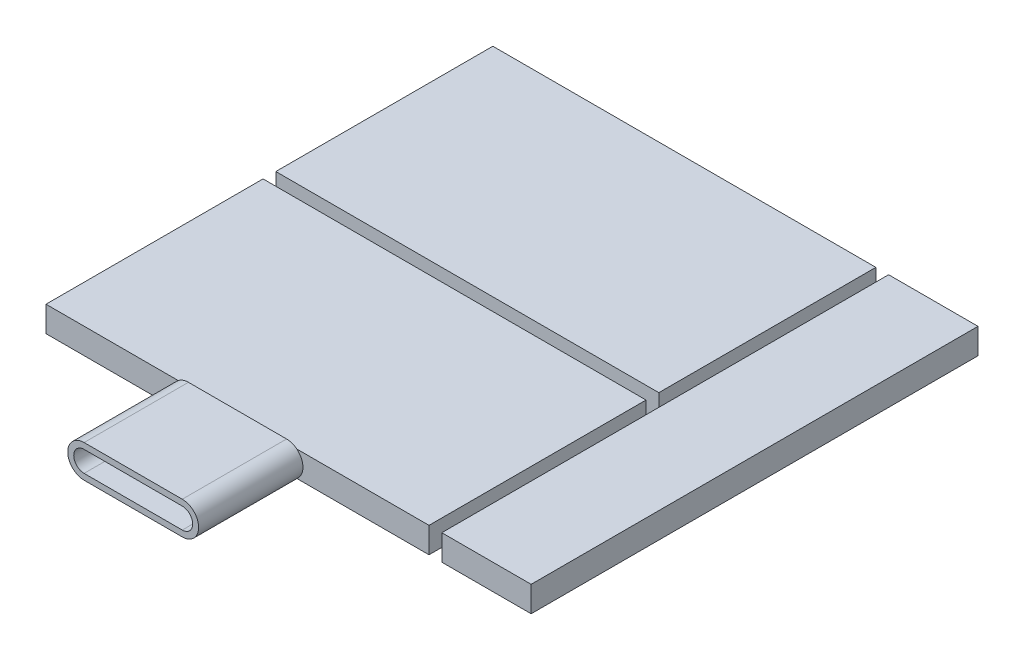
from build123d import *

# Parameters (mm, degrees)
SKETCH1_W               = 7
SKETCH1_H               = 35
CIRCUIT_DEPTH           = 2
SKETCH1_W_2             = 30
SKETCH1_H_2             = 17
CIRCUIT_2_DEPTH         = 2
CIRCUIT_3_DEPTH         = 2
USB_C_PORT_FEMALE_DEPTH = 8.17


with BuildPart() as part:
    # Sketch1 → Circuit (new body)
    with BuildSketch(Plane(origin=(0, 0, 0), x_dir=(1, 0, 0), z_dir=(0, 1, 0))):
        Rectangle(SKETCH1_W, SKETCH1_H)
    extrude(amount=CIRCUIT_DEPTH)


with BuildPart() as body_2:
    # Sketch1 → Circuit 2 (new body)
    with BuildSketch(Plane(origin=(0, 0, 0), x_dir=(1, 0, 0), z_dir=(0, 1, 0))):
        with Locations((-19.5, 9)):
            Rectangle(SKETCH1_W_2, SKETCH1_H_2)
    extrude(amount=CIRCUIT_2_DEPTH)


with BuildPart() as body_3:
    # Sketch1 → Circuit 3 (new body)
    with BuildSketch(Plane(origin=(0, 0, 0), x_dir=(1, 0, 0), z_dir=(0, 1, 0))):
        with Locations((-19.5, -9)):
            Rectangle(SKETCH1_W_2, SKETCH1_H_2)
    extrude(amount=CIRCUIT_3_DEPTH)

    # Sketch2 → USB-C Port Female (add)
    with BuildSketch(Plane.XY.offset(17.5)):
        with BuildLine():
            Line((-23.345, 2.28), (-15.655, 2.28))
            ThreePointArc((-15.655, 2.28), (-14.375, 1), (-15.655, -0.28))
            Line((-15.655, -0.28), (-23.345, -0.28))
            ThreePointArc((-23.345, -0.28), (-24.625, 1), (-23.345, 2.28))
        make_face()
        with BuildLine():
            Line((-23.345, 1.81239), (-15.655, 1.81239))
            ThreePointArc((-15.655, 1.81239), (-14.84261, 1), (-15.655, 0.18761))
            Line((-15.655, 0.18761), (-23.345, 0.18761))
            ThreePointArc((-23.345, 0.18761), (-24.15739, 1), (-23.345, 1.81239))
        make_face(mode=Mode.SUBTRACT)
    extrude(amount=USB_C_PORT_FEMALE_DEPTH)


solid = Compound([part.part, body_2.part, body_3.part])
